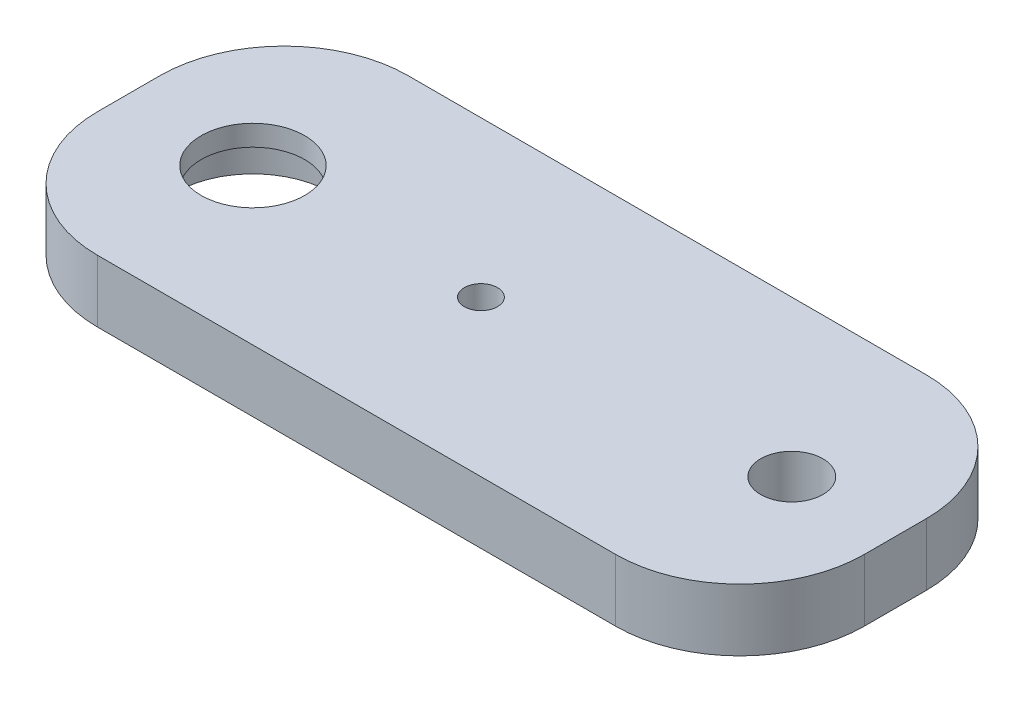
from build123d import *

# Parameters (mm, degrees)
SKETCH1_W           = 30
SKETCH1_H           = 15
BOSS_EXTRUDE2_DEPTH = 3
CUT_EXTRUDE1_REACH  = 19.037
SKETCH3_R           = 2.5
FILLET1_R           = 6
SKETCH5_W           = 12
SKETCH5_H           = 3
BOSS_EXTRUDE3_DEPTH = 10
SKETCH6_R           = 3.75
CUT_EXTRUDE4_DEPTH  = 2
SKETCH7_W           = 20
SKETCH7_H           = 7.5
CUT_EXTRUDE5_DEPTH  = 1
CUT_EXTRUDE6_REACH  = 25.135
SKETCH8_R           = 0.8
CUT_EXTRUDE7_REACH  = 25.243
SKETCH9_W           = 12
SKETCH9_H           = 10
SKETCH10_W          = 15
SKETCH10_H          = 3
BOSS_EXTRUDE4_DEPTH = 7
CUT_EXTRUDE8_REACH  = 25.436
SKETCH11_R          = 1.5
FILLET2_R           = 6


with BuildPart() as part:
    # Sketch1 → Boss-Extrude2 (new body)
    with BuildSketch(Plane(origin=(0, 0, 0), x_dir=(1, 0, 0), z_dir=(0, 1, 0))):
        Rectangle(SKETCH1_W, SKETCH1_H)
    extrude(amount=BOSS_EXTRUDE2_DEPTH)

    # Sketch3 → Cut-Extrude1 (cut, up to next)
    with BuildSketch(Plane(origin=(0, 3, 0), x_dir=(1, 0, 0), z_dir=(0, 1, 0)), mode=Mode.PRIVATE) as cut_extrude1_sk1:
        with Locations(Location((-9, 0, 0), (0, 0, 270))):
            Circle(SKETCH3_R)
    cut_extrude1_tool1 = extrude(cut_extrude1_sk1.sketch, amount=-CUT_EXTRUDE1_REACH, mode=Mode.PRIVATE) & part.part
    add(cut_extrude1_tool1.solids().sort_by_distance((-9, 3, 0))[0], mode=Mode.SUBTRACT)

    # Fillet1
    fillet1_edges = [part.edges().sort_by_distance(p)[0] for p in [
        (-15, 1.5, 7.5),
        (-15, 1.5, -7.5),
    ]]
    fillet(fillet1_edges, radius=FILLET1_R)

    # Sketch5 → Boss-Extrude3 (add)
    with BuildSketch(Plane.XY.offset(7.5)):
        with Locations((9, 1.5)):
            Rectangle(SKETCH5_W, SKETCH5_H)
    extrude(amount=BOSS_EXTRUDE3_DEPTH)

    # Sketch6 → Cut-Extrude4 (cut)
    with BuildSketch(Plane(origin=(0, 0, 0), x_dir=(-1, 0, 0), z_dir=(0, -1, 0))):
        with Locations(Location((9, 0, 0), (0, 0, 90))):
            Circle(SKETCH6_R)
    extrude(amount=-CUT_EXTRUDE4_DEPTH, mode=Mode.SUBTRACT)

    # Sketch7 → Cut-Extrude5 (cut)
    with BuildSketch(Plane(origin=(0, 0, 0), x_dir=(-1, 0, 0), z_dir=(0, -1, 0))):
        with Locations((-1, 0)):
            Rectangle(SKETCH7_W, SKETCH7_H)
    extrude(amount=-CUT_EXTRUDE5_DEPTH, mode=Mode.SUBTRACT)

    # Sketch8 → Cut-Extrude6 (cut, up to next)
    with BuildSketch(Plane(origin=(0, 1, 0), x_dir=(-1, 0, 0), z_dir=(0, -1, 0)), mode=Mode.PRIVATE) as cut_extrude6_sk1:
        with Locations(Location((-2, 0, 0), (0, 0, 90))):
            Circle(SKETCH8_R)
    cut_extrude6_tool1 = extrude(cut_extrude6_sk1.sketch, amount=-CUT_EXTRUDE6_REACH, mode=Mode.PRIVATE) & part.part
    add(cut_extrude6_tool1.solids().sort_by_distance((2, 1, 0))[0], mode=Mode.SUBTRACT)

    # Sketch9 → Cut-Extrude7 (cut, up to next)
    with BuildSketch(Plane(origin=(0, 0, 0), x_dir=(1, 0, 0), z_dir=(0, 1, 0)), mode=Mode.PRIVATE) as cut_extrude7_sk1:
        with Locations((9, -12.5)):
            Rectangle(SKETCH9_W, SKETCH9_H)
    cut_extrude7_tool1 = extrude(cut_extrude7_sk1.sketch, amount=CUT_EXTRUDE7_REACH, mode=Mode.PRIVATE) & part.part
    add(cut_extrude7_tool1.solids().sort_by_distance((9, 0, 12.5))[0], mode=Mode.SUBTRACT)

    # Sketch10 → Boss-Extrude4 (add)
    with BuildSketch(Plane(origin=(15, 0, 0), x_dir=(0, 0, -1), z_dir=(1, 0, 0))):
        with Locations((0, 1.5)):
            Rectangle(SKETCH10_W, SKETCH10_H)
    extrude(amount=BOSS_EXTRUDE4_DEPTH)

    # Sketch11 → Cut-Extrude8 (cut, up to next)
    with BuildSketch(Plane(origin=(0, 3, 0), x_dir=(1, 0, 0), z_dir=(0, 1, 0)), mode=Mode.PRIVATE) as cut_extrude8_sk1:
        with Locations(Location((17, 0, 0), (0, 0, 270))):
            Circle(SKETCH11_R)
    cut_extrude8_tool1 = extrude(cut_extrude8_sk1.sketch, amount=-CUT_EXTRUDE8_REACH, mode=Mode.PRIVATE) & part.part
    add(cut_extrude8_tool1.solids().sort_by_distance((17, 3, 0))[0], mode=Mode.SUBTRACT)

    # Fillet2
    fillet2_edges = [part.edges().sort_by_distance(p)[0] for p in [
        (22, 1.5, -7.5),
        (22, 1.5, 7.5),
    ]]
    fillet(fillet2_edges, radius=FILLET2_R)


solid = part.part
